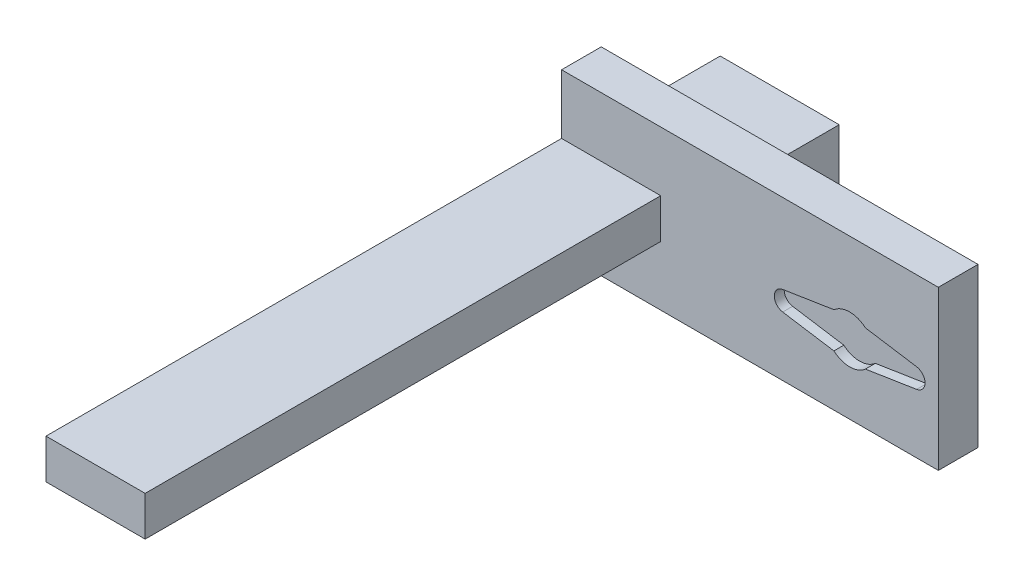
from build123d import *

# Parameters (mm, degrees)
SKETCH3_W            = 45
SKETCH3_H            = 15
BOSS_EXTRUDE1_DEPTH  = 10
CUT_EXTRUDE1_DEPTH   = 2.5
SKETCH11_W           = 45
SKETCH11_H           = 10
BOSS_EXTRUDE5_DEPTH  = 10
SKETCH14_W           = 45
SKETCH14_H           = 10
BOSS_EXTRUDE7_DEPTH  = 15
SKETCH20_W           = 10
SKETCH20_H           = 40
BOSS_EXTRUDE10_DEPTH = 50
SKETCH21_W           = 25
SKETCH21_H           = 10
BOSS_EXTRUDE11_DEPTH = 130
SKETCH22_W           = 30
SKETCH22_H           = 6
BOSS_EXTRUDE12_DEPTH = 30
SKETCH23_W           = 30
SKETCH23_H           = 30
BOSS_EXTRUDE13_DEPTH = 8.5


with BuildPart() as part:
    # Sketch3 → Boss-Extrude1 (new body)
    with BuildSketch(Plane.XY):
        with Locations((-0.138845539, 0.05888455)):
            Rectangle(SKETCH3_W, SKETCH3_H)
    extrude(amount=-BOSS_EXTRUDE1_DEPTH)

    # Sketch2 → Cut-Extrude1 (cut)
    with BuildSketch(Plane.XY):
        with BuildLine():
            Line((-16.888114198, 2.469689731), (-3.968626967, 4.5))
            ThreePointArc((-3.968626967, 4.5), (0, 6), (3.968626967, 4.5))
            Line((3.968626967, 4.5), (16.888114198, 2.469689731))
            ThreePointArc((16.888114198, 2.469689731), (19, 0), (16.888114198, -2.469689731))
            Line((16.888114198, -2.469689731), (3.968626967, -4.5))
            ThreePointArc((3.968626967, -4.5), (0, -6), (-3.968626967, -4.5))
            Line((-3.968626967, -4.5), (-16.888114198, -2.469689731))
            ThreePointArc((-16.888114198, -2.469689731), (-19, 0), (-16.888114198, 2.469689731))
        make_face()
    extrude(amount=-CUT_EXTRUDE1_DEPTH, mode=Mode.SUBTRACT)

    # Sketch11 → Boss-Extrude5 (add)
    with BuildSketch(Plane.XZ.offset(7.44111545)):
        with Locations((-0.138845539, -5)):
            Rectangle(SKETCH11_W, SKETCH11_H)
    extrude(amount=BOSS_EXTRUDE5_DEPTH)

    # Sketch14 → Boss-Extrude7 (add)
    with BuildSketch(Plane(origin=(0, 7.55888455, 0), x_dir=(1, 0, 0), z_dir=(0, 1, 0))):
        with Locations((-0.138845539, 5)):
            Rectangle(SKETCH14_W, SKETCH14_H)
    extrude(amount=BOSS_EXTRUDE7_DEPTH)

    # Sketch20 → Boss-Extrude10 (add)
    with BuildSketch(Plane.ZY.offset(22.638845539)):
        with Locations((-5, 2.55888455)):
            Rectangle(SKETCH20_W, SKETCH20_H)
    extrude(amount=BOSS_EXTRUDE10_DEPTH)

    # Sketch21 → Boss-Extrude11 (add)
    with BuildSketch(Plane.XY):
        with Locations((-60.138845539, 2.55888455)):
            Rectangle(SKETCH21_W, SKETCH21_H)
    extrude(amount=BOSS_EXTRUDE11_DEPTH)

    # Sketch22 → Boss-Extrude12 (add)
    with BuildSketch(Plane(origin=(0, 0, -10), x_dir=(-1, 0, 0), z_dir=(0, 0, -1))):
        with Locations((57.638845539, 2.55888455)):
            Rectangle(SKETCH22_W, SKETCH22_H)
    extrude(amount=BOSS_EXTRUDE12_DEPTH)

    # Sketch23 → Boss-Extrude13 (add)
    with BuildSketch(Plane.XZ.offset(0.44111545)):
        with Locations((-57.638845539, -25)):
            Rectangle(SKETCH23_W, SKETCH23_H)
    extrude(amount=BOSS_EXTRUDE13_DEPTH)


solid = part.part
